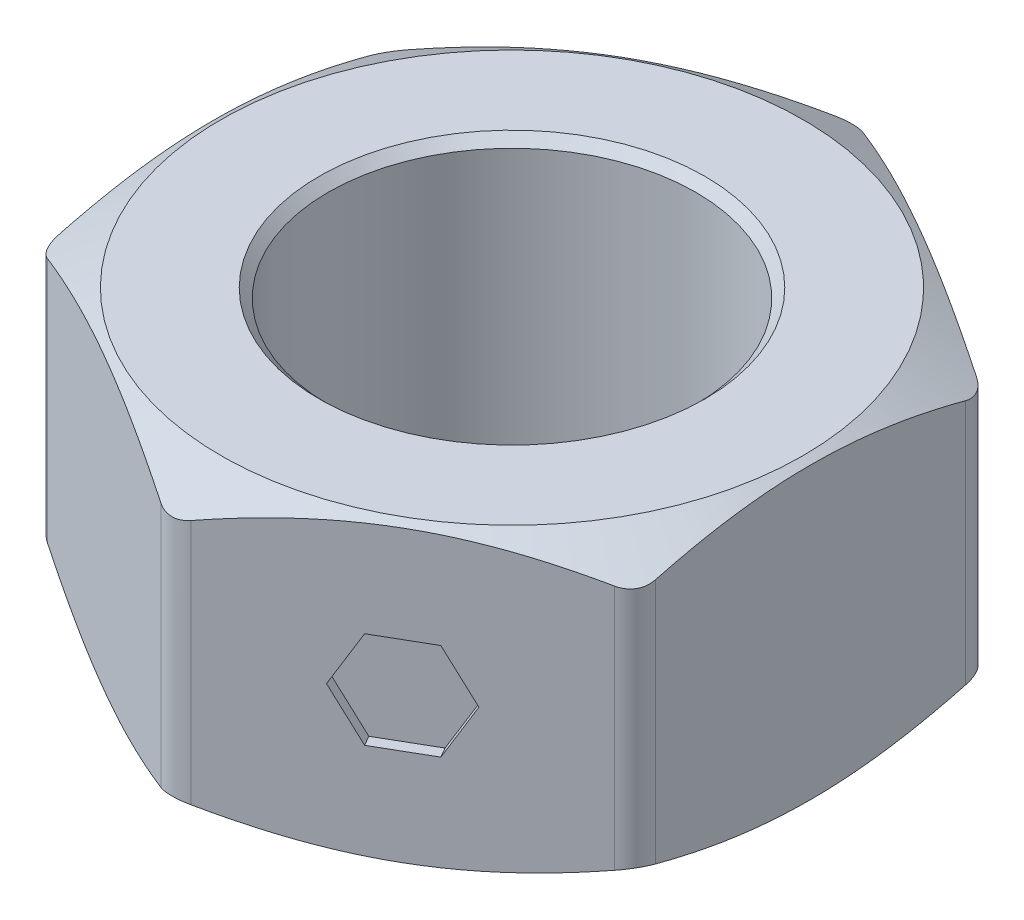
from build123d import *

# Parameters (mm, degrees)
BOSS_EXTRUDE1_DEPTH      = 3.25
BOSS_EXTRUDE1_DEPTH_BACK = 3.25
SKETCH2_R                = 4
FILLET1_R                = 0.65
CUT_EXTRUDE2_DEPTH       = 0.25


with BuildPart() as part:
    # Sketch2 → Boss-Extrude1 (new, two sides: drawn at the far end of the back side and taken through both)
    with BuildSketch(Plane(origin=(0, 0, 0), x_dir=(1, 0, 0), z_dir=(0, 1, 0)).offset(-BOSS_EXTRUDE1_DEPTH_BACK)):
        Polygon((0, 7.505553499), (-6.5, 3.75277675), (-6.5, -3.75277675), (0, -7.505553499), (6.5, -3.75277675), (6.5, 3.75277675), align=None)
        with Locations(Location((0, 0, 0), (0, 0, 90))):
            Circle(SKETCH2_R, mode=Mode.SUBTRACT)
    extrude(amount=BOSS_EXTRUDE1_DEPTH + BOSS_EXTRUDE1_DEPTH_BACK)

    # Fillet1
    fillet1_edges = [part.edges().sort_by_distance(p)[0] for p in [
        (6.5, 0, -3.75277675),
        (6.5, 0, 3.75277675),
        (0, 0, 7.505553499),
        (-6.5, 0, 3.75277675),
        (-6.5, 0, -3.75277675),
        (0, 0, -7.505553499),
    ]]
    fillet(fillet1_edges, radius=FILLET1_R)

    # Sketch3 → Cut-Revolve2 (revolve, cut)
    with BuildSketch(Plane(origin=(0, 0, 0), x_dir=(0, 0, -1), z_dir=(1, 0, 0)), mode=Mode.PRIVATE) as cut_revolve2_sk:
        Polygon((6.3375, -3.25), (7.505553499, -2.575623998), (7.505553499, -3.25), align=None)
        Polygon((4, 3.25), (4, 3.05), (4.2, 3.25), align=None)
        Polygon((4, -3.25), (4, -3.05), (4.2, -3.25), align=None)
        Polygon((6.3375, 3.25), (7.505553499, 2.575623998), (7.505553499, 3.25), align=None)
    revolve(cut_revolve2_sk.sketch.rotate(Axis((0, -3.25, 0), (0, 1, 0)), 270), axis=Axis((0, -3.25, 0), (0, 1, 0)), mode=Mode.SUBTRACT)

    # Sketch12 → Cut-Extrude2 (cut)
    with BuildSketch(Plane(origin=(3.25, 0, 5.629165125), x_dir=(0.8660254037844384, 0, -0.5000000000000006), z_dir=(0.5000000000000006, 0, 0.8660254037844385))):
        Polygon((-1.214814445, 0), (-0.607407223, -1.05206017), (0.607407223, -1.05206017), (1.214814445, 0), (0.607407223, 1.05206017), (-0.607407223, 1.05206017), align=None)
    extrude(amount=-CUT_EXTRUDE2_DEPTH, mode=Mode.SUBTRACT)


solid = part.part
